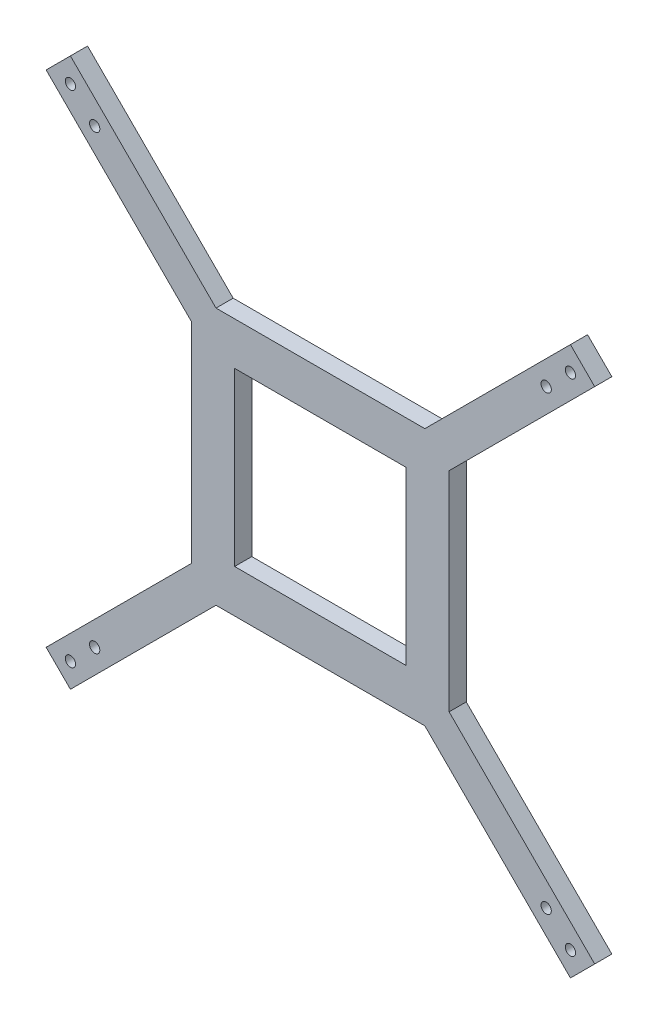
from build123d import *

# Parameters (mm, degrees)
SKETCH1_R           = 1.5
SKETCH1_W           = 50
SKETCH1_H           = 50
BOSS_EXTRUDE1_DEPTH = 5


with BuildPart() as part:
    # Sketch1 → Boss-Extrude1 (new body)
    with BuildSketch(Plane.XY):
        Polygon((-79.926406871, -72.855339059), (-37.5, -30.428932188), (-37.5, 30.428932188), (-79.926406871, 72.855339059), (-72.855339059, 79.926406871), (-30.428932188, 37.5), (30.428932188, 37.5), (72.855339059, 79.926406871), (79.926406871, 72.855339059), (37.5, 30.428932188), (37.5, -30.428932188), (79.926406871, -72.855339059), (72.855339059, -79.926406871), (30.428932188, -37.5), (-30.428932188, -37.5), (-72.855339059, -79.926406871), align=None)
        with Locations((72.855339059, 72.855339059)):
            Circle(SKETCH1_R, mode=Mode.SUBTRACT)
        with Locations((65.784271247, 65.784271247)):
            Circle(SKETCH1_R, mode=Mode.SUBTRACT)
        with Locations(Location((-65.784271247, 65.784271247, 0), (0, 0, 180))):
            Circle(SKETCH1_R, mode=Mode.SUBTRACT)
        with Locations(Location((-72.855339059, 72.855339059, 0), (0, 0, 180))):
            Circle(SKETCH1_R, mode=Mode.SUBTRACT)
        with Locations(Location((72.855339059, -72.855339059, 0), (0, 0, 180))):
            Circle(SKETCH1_R, mode=Mode.SUBTRACT)
        with Locations(Location((65.784271247, -65.784271247, 0), (0, 0, 180))):
            Circle(SKETCH1_R, mode=Mode.SUBTRACT)
        with Locations((-72.855339059, -72.855339059)):
            Circle(SKETCH1_R, mode=Mode.SUBTRACT)
        with Locations((-65.784271247, -65.784271247)):
            Circle(SKETCH1_R, mode=Mode.SUBTRACT)
        Rectangle(SKETCH1_W, SKETCH1_H, mode=Mode.SUBTRACT)
    extrude(amount=BOSS_EXTRUDE1_DEPTH)


solid = part.part
